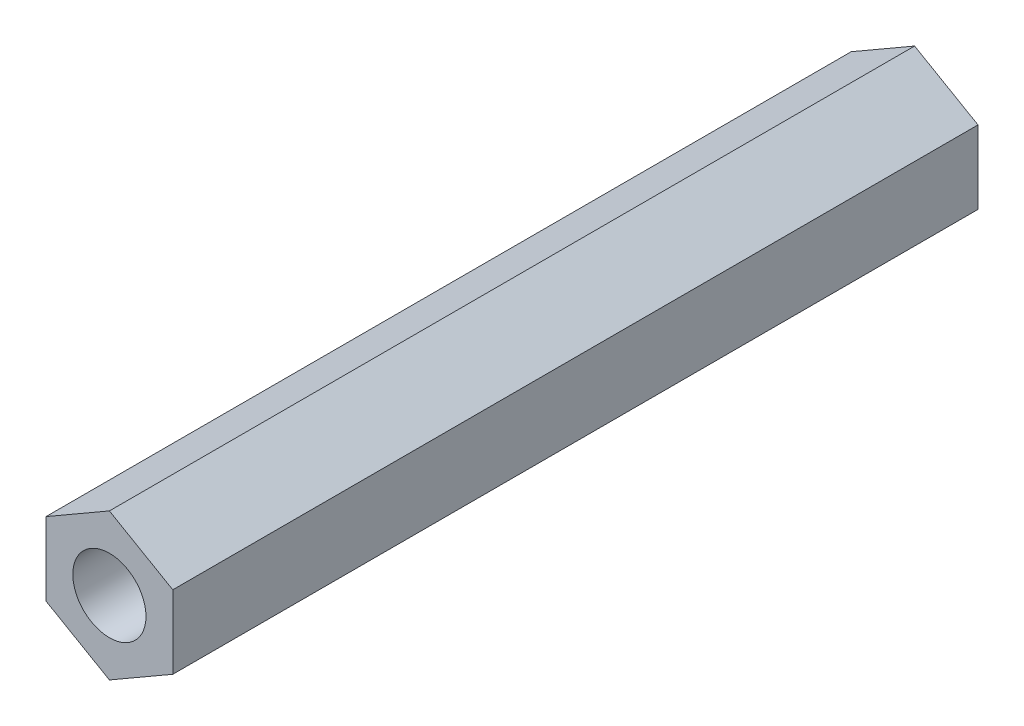
from build123d import *

# Parameters (mm, degrees)
BOSS_EXTRUDE1_DEPTH = 5.5
SKETCH2_R           = 0.25
CUT_EXTRUDE1_DEPTH  = 5.5


with BuildPart() as part:
    # Sketch1 → Boss-Extrude1 (new body)
    with BuildSketch(Plane.XY):
        Polygon((0, 0.5), (-0.433012702, 0.25), (-0.433012702, -0.25), (0, -0.5), (0.433012702, -0.25), (0.433012702, 0.25), align=None)
    extrude(amount=BOSS_EXTRUDE1_DEPTH)

    # Sketch2 → Cut-Extrude1 (cut)
    with BuildSketch(Plane.XY.offset(5.5)):
        Circle(SKETCH2_R)
    extrude(amount=-CUT_EXTRUDE1_DEPTH, mode=Mode.SUBTRACT)


solid = part.part
